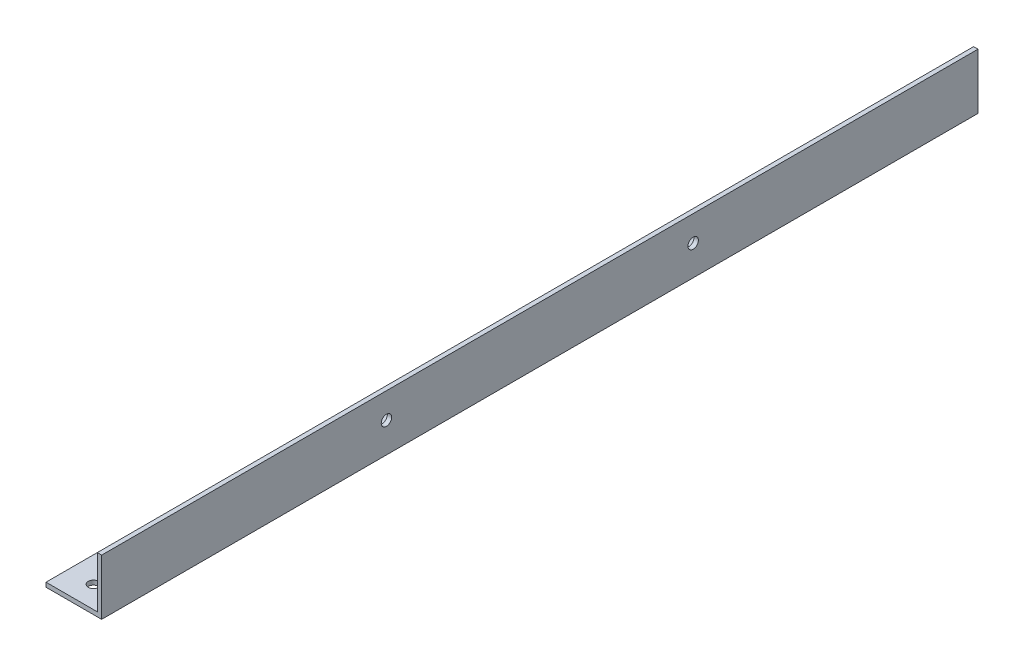
from build123d import *

# Parameters (mm, degrees)
BOSS_EXTRUDE1_DEPTH                 = 200
F_3_32_0_09375_DIAMETER_HOLE1_D     = 2.38125
F_3_32_0_09375_DIAMETER_HOLE1_DEPTH = 5
F_3_32_0_09375_DIAMETER_HOLE1_TIP   = 0.715399675
F_3_32_0_09375_DIAMETER_HOLE2_D     = 2.38125
F_3_32_0_09375_DIAMETER_HOLE2_DEPTH = 5
F_3_32_0_09375_DIAMETER_HOLE2_TIP   = 0.715399675


with BuildPart() as part:
    # Sketch1 → Boss-Extrude1 (new body)
    with BuildSketch(Plane.XY):
        Polygon((-6.38902439, -3.969512195), (5.31097561, -3.969512195), (5.31097561, 7.730487805), (6.31097561, 7.730487805), (6.31097561, -4.969512195), (-6.38902439, -4.969512195), align=None)
    extrude(amount=BOSS_EXTRUDE1_DEPTH)

    # 3/32 (0.09375) Diameter Hole1
    with Locations(Plane(origin=(0, -3.969512195, 0), x_dir=(1, 0, 0), z_dir=(0, 1, 0))):
        with Locations((-0.53902439, -4.970860359), (-0.53902439, -100), (-0.53902439, -195)):
            Hole(F_3_32_0_09375_DIAMETER_HOLE1_D / 2, depth=F_3_32_0_09375_DIAMETER_HOLE1_DEPTH)
            with Locations((0, 0, -(F_3_32_0_09375_DIAMETER_HOLE1_DEPTH + F_3_32_0_09375_DIAMETER_HOLE1_TIP / 2))):  # 118° drill point
                Cone(0, F_3_32_0_09375_DIAMETER_HOLE1_D / 2, F_3_32_0_09375_DIAMETER_HOLE1_TIP, mode=Mode.SUBTRACT)

    # 3/32 (0.09375) Diameter Hole2
    with Locations(Plane.ZY.offset(-5.31097561)):
        with Locations((65, 1.880487805), (135, 1.880487805)):
            Hole(F_3_32_0_09375_DIAMETER_HOLE2_D / 2, depth=F_3_32_0_09375_DIAMETER_HOLE2_DEPTH)
            with Locations((0, 0, -(F_3_32_0_09375_DIAMETER_HOLE2_DEPTH + F_3_32_0_09375_DIAMETER_HOLE2_TIP / 2))):  # 118° drill point
                Cone(0, F_3_32_0_09375_DIAMETER_HOLE2_D / 2, F_3_32_0_09375_DIAMETER_HOLE2_TIP, mode=Mode.SUBTRACT)


solid = part.part
